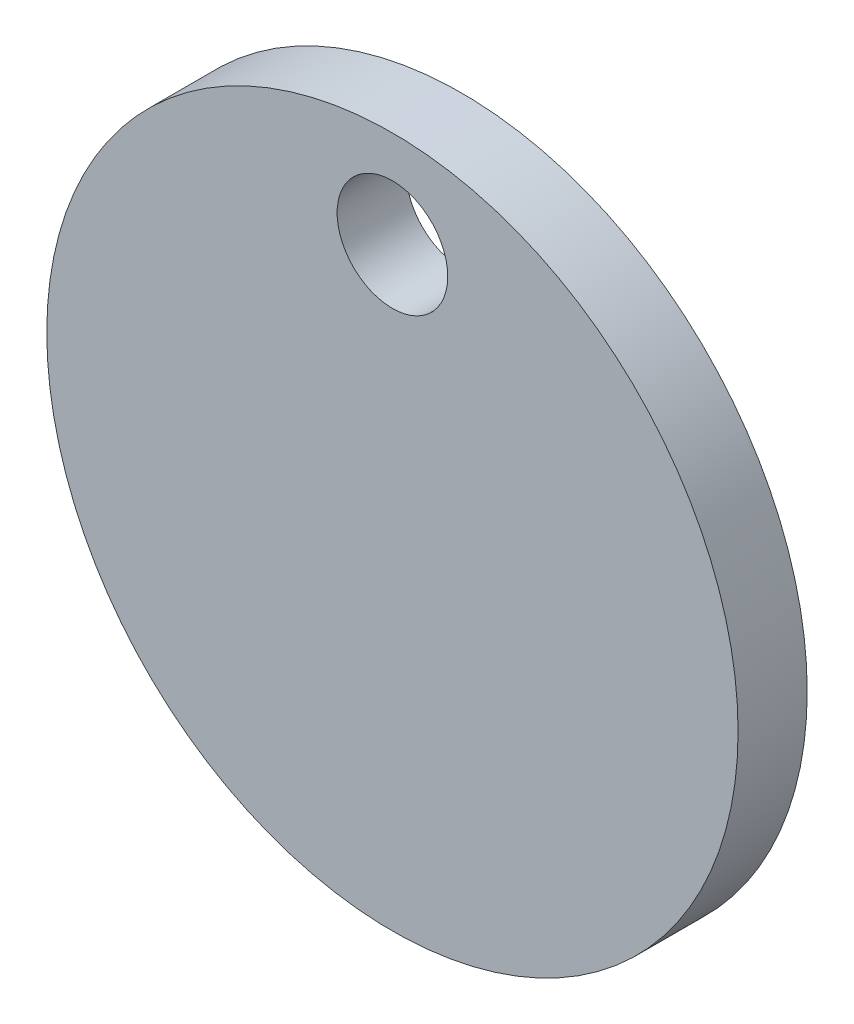
from build123d import *

# Parameters (mm, degrees)
SKETCH1_R           = 50
BOSS_EXTRUDE1_DEPTH = 10
SKETCH2_R           = 8
CUT_EXTRUDE1_DEPTH  = 72.414284285


with BuildPart() as part:
    # Sketch1 → Boss-Extrude1 (new body)
    with BuildSketch(Plane.XY):
        Circle(SKETCH1_R)
    extrude(amount=BOSS_EXTRUDE1_DEPTH)

    # Sketch2 → Cut-Extrude1 (cut, through all)
    with BuildSketch(Plane.XY.offset(10)):
        with Locations((0, 36)):
            Circle(SKETCH2_R)
    extrude(amount=-CUT_EXTRUDE1_DEPTH, mode=Mode.SUBTRACT)


solid = part.part
